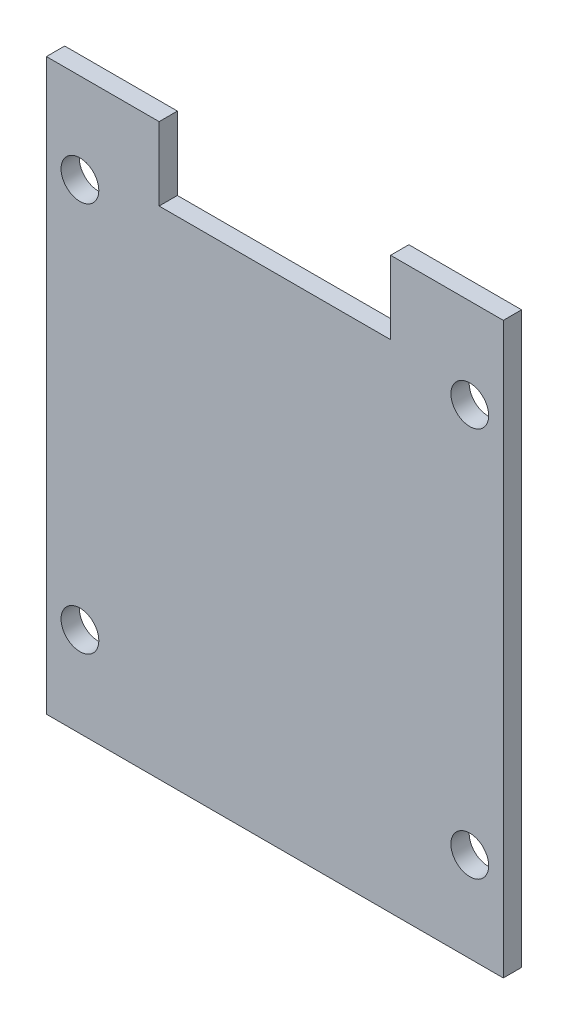
from build123d import *

# Parameters (mm, degrees)
SKETCH1_W            = 75
SKETCH1_H            = 93.5
BOSS_EXTRUDE1_DEPTH  = 3
SKETCH2_R            = 3.1
CUT_EXTRUDE1_DEPTH   = 61.006770451
LPATTERN1_COUNT      = 2
LPATTERN1_PITCH      = 64
LPATTERN1_COUNT_DIR2 = 2
LPATTERN1_PITCH_DIR2 = 64
SKETCH3_W            = 38
SKETCH3_H            = 12
CUT_EXTRUDE2_DEPTH   = 61.006770451


with BuildPart() as part:
    # Sketch1 → Boss-Extrude1 (new body)
    with BuildSketch(Plane.XY):
        Rectangle(SKETCH1_W, SKETCH1_H)
    extrude(amount=BOSS_EXTRUDE1_DEPTH)

    # Sketch2 → Cut-Extrude1 (cut, through all)
    with BuildSketch(Plane.XY.offset(3)):
        with Locations((-32, 32)):
            Circle(SKETCH2_R)
    cut_extrude1 = extrude(amount=-CUT_EXTRUDE1_DEPTH, mode=Mode.SUBTRACT)

    # LPattern1: Cut-Extrude1 2 × 2
    with Locations(*[(i * LPATTERN1_PITCH, -j * LPATTERN1_PITCH_DIR2, 0) for i in range(LPATTERN1_COUNT) for j in range(LPATTERN1_COUNT_DIR2) if (i, j) != (0, 0)]):
        add(cut_extrude1, mode=Mode.SUBTRACT)

    # Sketch3 → Cut-Extrude2 (cut, through all)
    with BuildSketch(Plane.XY.offset(3)):
        with Locations((0, 40.75)):
            Rectangle(SKETCH3_W, SKETCH3_H)
    extrude(amount=-CUT_EXTRUDE2_DEPTH, mode=Mode.SUBTRACT)


solid = part.part
